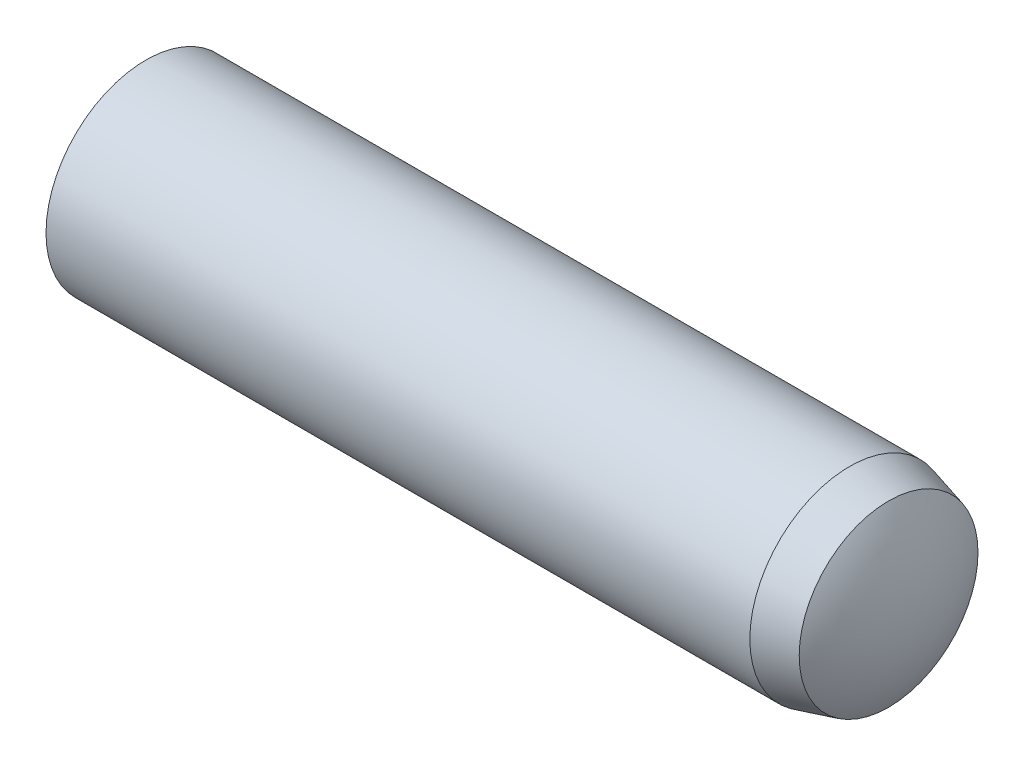
from build123d import *

# Parameters (mm, degrees)
EXTRUDE1_DEPTH      = 5
EXTRUDE1_DEPTH_BACK = 5
SKETCH2_R           = 1.25


with BuildPart() as part:
    # Sketch2 → Extrude1 (new, two sides: drawn at the far end of the back side and taken through both)
    with BuildSketch(Plane(origin=(0, 0, 0), x_dir=(0, 0, -1), z_dir=(1, 0, 0)).offset(-EXTRUDE1_DEPTH_BACK)):
        Circle(SKETCH2_R)
    extrude(amount=EXTRUDE1_DEPTH + EXTRUDE1_DEPTH_BACK)

    # Sketch5 → Cut-Revolve1 (revolve, cut)
    with BuildSketch(Plane.XY, mode=Mode.PRIVATE) as cut_revolve1_sk:
        with BuildLine():
            Line((4.1875, 1.25), (4.1875, 1.75))
            Line((4.1875, 1.75), (5.5, 1.75))
            Line((5.5, 1.75), (5.5, 0))
            Line((5.5, 0), (5, 0))
            ThreePointArc((5, 0), (4.917106283, 0.582800324), (4.675, 1.119374769))
            Line((4.675, 1.119374769), (4.1875, 1.25))
        make_face()
        with BuildLine():
            Line((-4.625, 1.25), (-4.625, 1.75))
            Line((-4.625, 1.75), (-5.5, 1.75))
            Line((-5.5, 1.75), (-5.5, 0))
            Line((-5.5, 0), (-5, 0))
            ThreePointArc((-5, 0), (-4.904230523, 0.652519157), (-4.625, 1.25))
        make_face()
    revolve(cut_revolve1_sk.sketch.rotate(Axis((-5, 0, 0), (1, 0, 0)), 90), axis=Axis((-5, 0, 0), (1, 0, 0)), mode=Mode.SUBTRACT)


solid = part.part
